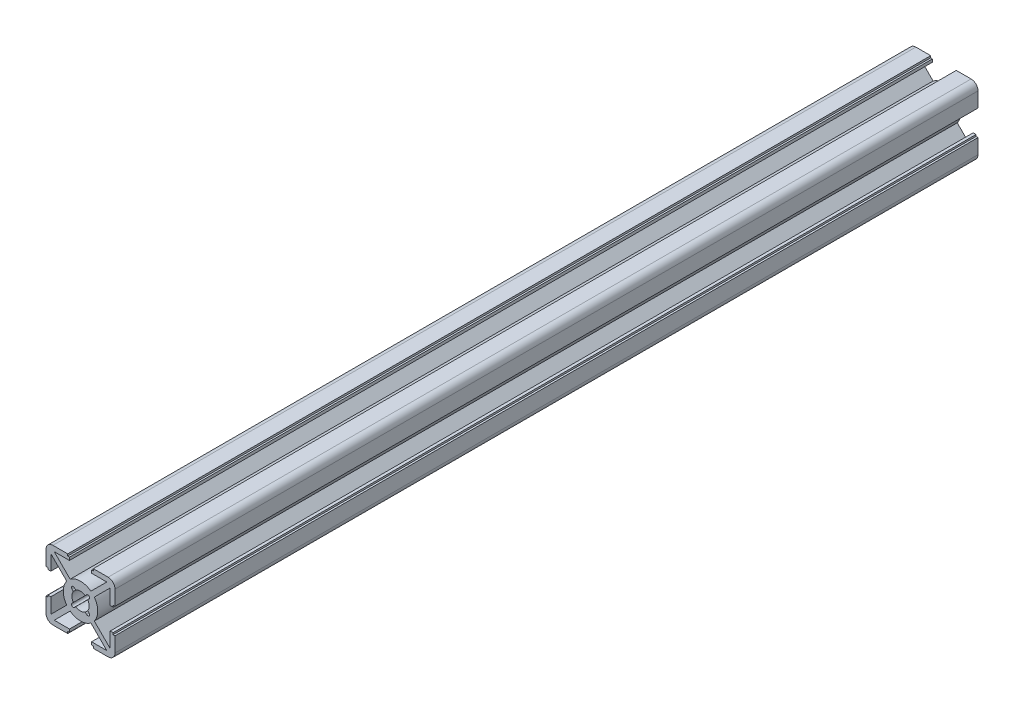
from build123d import *

# Parameters (mm, degrees)
Y_KSEKLIK_EKSTR_ZYON1_DEPTH = 250


with BuildPart() as part:
    # Çizim1 → Yükseklik-Ekstrüzyon1 (new body)
    with BuildSketch(Plane.XY):
        with BuildLine():
            Line((8.6, 7.610050506), (8.6, 3.2))
            Line((8.6, 3.2), (9.44, 3.2))
            Line((9.44, 3.2), (9.44, 3.7))
            Line((9.44, 3.7), (10, 3.7))
            Line((10, 3.7), (10, 8))
            ThreePointArc((10, 8), (9.414213562, 9.414213562), (8, 10))
            Line((8, 10), (3.7, 10))
            Line((3.7, 10), (3.7, 9.44))
            Line((3.7, 9.44), (3.2, 9.44))
            Line((3.2, 9.44), (3.2, 8.6))
            Line((3.2, 8.6), (7.610050506, 8.6))
            Line((7.610050506, 8.6), (3.005739466, 3.99568896))
            ThreePointArc((3.005739466, 3.99568896), (0, 5), (-3.005739466, 3.99568896))
            Line((-3.005739466, 3.99568896), (-7.610050506, 8.6))
            Line((-7.610050506, 8.6), (-3.2, 8.6))
            Line((-3.2, 8.6), (-3.2, 9.44))
            Line((-3.2, 9.44), (-3.7, 9.44))
            Line((-3.7, 9.44), (-3.7, 10))
            Line((-3.7, 10), (-8, 10))
            ThreePointArc((-8, 10), (-9.414213562, 9.414213562), (-10, 8))
            Line((-10, 8), (-10, 3.7))
            Line((-10, 3.7), (-9.44, 3.7))
            Line((-9.44, 3.7), (-9.44, 3.2))
            Line((-9.44, 3.2), (-8.6, 3.2))
            Line((-8.6, 3.2), (-8.6, 7.610050506))
            Line((-8.6, 7.610050506), (-3.99568896, 3.005739466))
            ThreePointArc((-3.99568896, 3.005739466), (-5, 0), (-3.99568896, -3.005739466))
            Line((-3.99568896, -3.005739466), (-8.6, -7.610050506))
            Line((-8.6, -7.610050506), (-8.6, -3.2))
            Line((-8.6, -3.2), (-9.44, -3.2))
            Line((-9.44, -3.2), (-9.44, -3.7))
            Line((-9.44, -3.7), (-10, -3.7))
            Line((-10, -3.7), (-10, -8))
            ThreePointArc((-10, -8), (-9.414213562, -9.414213562), (-8, -10))
            Line((-8, -10), (-3.7, -10))
            Line((-3.7, -10), (-3.7, -9.44))
            Line((-3.7, -9.44), (-3.2, -9.44))
            Line((-3.2, -9.44), (-3.2, -8.6))
            Line((-3.2, -8.6), (-7.610050506, -8.6))
            Line((-7.610050506, -8.6), (-3.005739466, -3.99568896))
            ThreePointArc((-3.005739466, -3.99568896), (0, -5), (3.005739466, -3.99568896))
            Line((3.005739466, -3.99568896), (7.610050506, -8.6))
            Line((7.610050506, -8.6), (3.2, -8.6))
            Line((3.2, -8.6), (3.2, -9.44))
            Line((3.2, -9.44), (3.7, -9.44))
            Line((3.7, -9.44), (3.7, -10))
            Line((3.7, -10), (8, -10))
            ThreePointArc((8, -10), (9.414213562, -9.414213562), (10, -8))
            Line((10, -8), (10, -3.7))
            Line((10, -3.7), (9.44, -3.7))
            Line((9.44, -3.7), (9.44, -3.2))
            Line((9.44, -3.2), (8.6, -3.2))
            Line((8.6, -3.2), (8.6, -7.610050506))
            Line((8.6, -7.610050506), (3.99568896, -3.005739466))
            ThreePointArc((3.99568896, -3.005739466), (5, 0), (3.99568896, 3.005739466))
            Line((3.99568896, 3.005739466), (8.6, 7.610050506))
        make_face()
        with BuildLine():
            Line((2.474873734, 1.767766953), (2.085604198, 1.378497417))
            ThreePointArc((2.085604198, 1.378497417), (2.5, 0), (2.085604198, -1.378497417))
            Line((2.085604198, -1.378497417), (2.474873734, -1.767766953))
            ThreePointArc((2.474873734, -1.767766953), (2.474873734, -2.474873734), (1.767766953, -2.474873734))
            Line((1.767766953, -2.474873734), (1.378497417, -2.085604198))
            ThreePointArc((1.378497417, -2.085604198), (0, -2.5), (-1.378497417, -2.085604198))
            Line((-1.378497417, -2.085604198), (-1.767766953, -2.474873734))
            ThreePointArc((-1.767766953, -2.474873734), (-2.474873734, -2.474873734), (-2.474873734, -1.767766953))
            Line((-2.474873734, -1.767766953), (-2.085604198, -1.378497417))
            ThreePointArc((-2.085604198, -1.378497417), (-2.5, 0), (-2.085604198, 1.378497417))
            Line((-2.085604198, 1.378497417), (-2.474873734, 1.767766953))
            ThreePointArc((-2.474873734, 1.767766953), (-2.474873734, 2.474873734), (-1.767766953, 2.474873734))
            Line((-1.767766953, 2.474873734), (-1.378497417, 2.085604198))
            ThreePointArc((-1.378497417, 2.085604198), (0, 2.5), (1.378497417, 2.085604198))
            Line((1.378497417, 2.085604198), (1.767766953, 2.474873734))
            ThreePointArc((1.767766953, 2.474873734), (2.474873734, 2.474873734), (2.474873734, 1.767766953))
        make_face(mode=Mode.SUBTRACT)
    extrude(amount=Y_KSEKLIK_EKSTR_ZYON1_DEPTH)


solid = part.part
